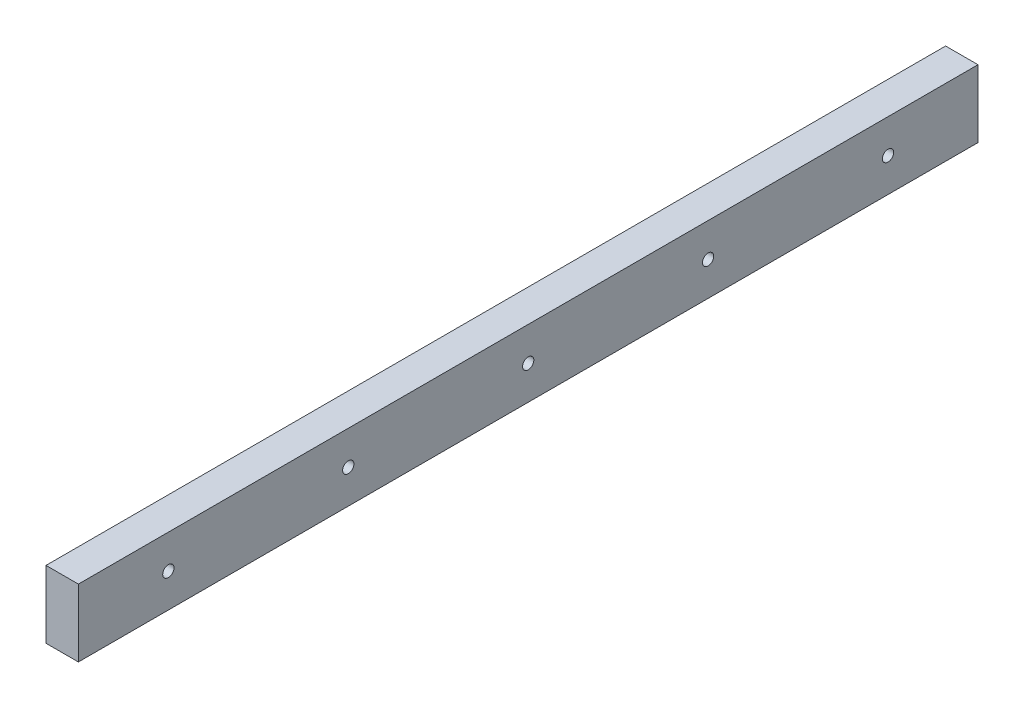
from build123d import *

# Parameters (mm, degrees)
SKETCH1_W           = 508
SKETCH1_H           = 38.1
BOSS_EXTRUDE1_DEPTH = 18.288
SKETCH2_R           = 3.175
CUT_EXTRUDE1_DEPTH  = 256.369053419


with BuildPart() as part:
    # Sketch1 → Boss-Extrude1 (new body)
    with BuildSketch(Plane(origin=(0, 0, 0), x_dir=(0, 0, -1), z_dir=(1, 0, 0))):
        Rectangle(SKETCH1_W, SKETCH1_H)
    extrude(amount=BOSS_EXTRUDE1_DEPTH)

    # Sketch2 → Cut-Extrude1 (cut, through all)
    with BuildSketch(Plane(origin=(18.288, 0, 0), x_dir=(0, 0, -1), z_dir=(1, 0, 0))):
        with Locations((203.2, 0)):
            Circle(SKETCH2_R)
        with Locations((101.6, 0)):
            Circle(SKETCH2_R)
        Circle(SKETCH2_R)
        with Locations((-101.6, 0)):
            Circle(SKETCH2_R)
        with Locations((-203.2, 0)):
            Circle(SKETCH2_R)
    extrude(amount=-CUT_EXTRUDE1_DEPTH, mode=Mode.SUBTRACT)


solid = part.part
